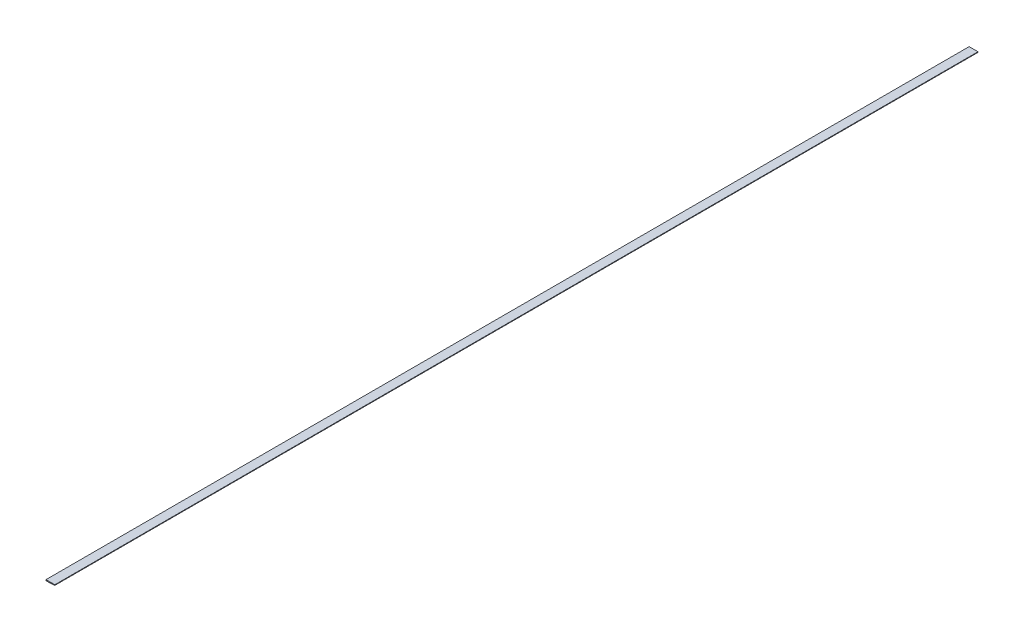
from build123d import *

# Parameters (mm, degrees)
BOSS_EXTRUDE1_DEPTH = 5214.4


with BuildPart() as part:
    # Sketch2 → Boss-Extrude1 (new body)
    with BuildSketch(Plane.XY):
        Polygon((2095.63, 25.4), (2070.63, 25.4), (2070.63, 30.840674957), (2120.63, 30.840674957), (2120.63, 27.587216588), (2108.245529289, 26.503715797), align=None)
    extrude(amount=-BOSS_EXTRUDE1_DEPTH)


solid = part.part
